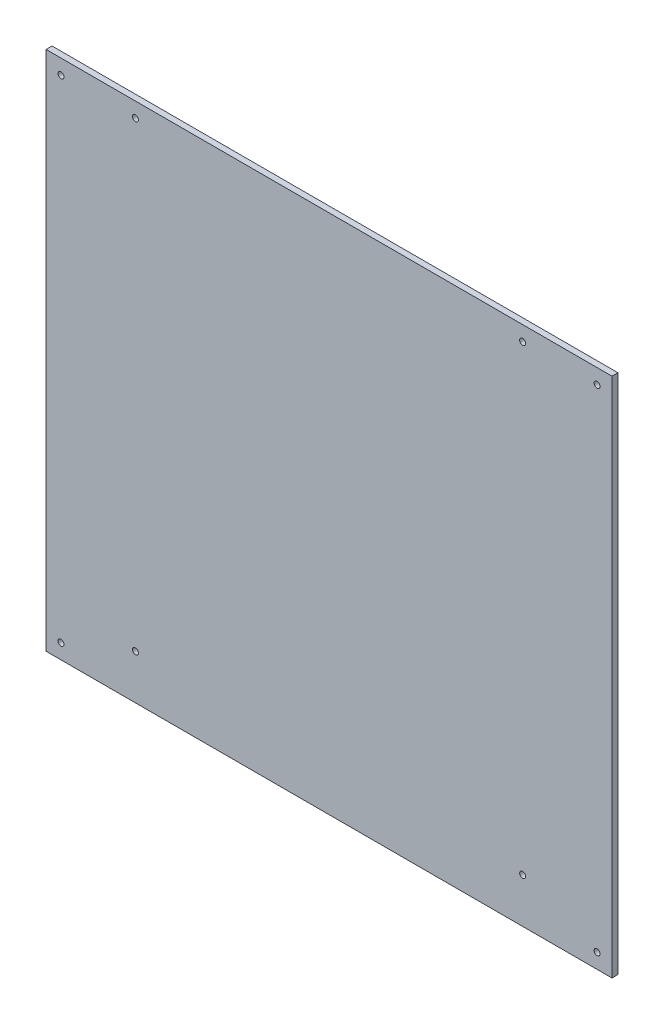
from build123d import *

# Parameters (mm, degrees)
SKICA1_W                = 380
SKICA1_H                = 350
SKICA1_R                = 2
P_IDAT_VYSUNUT_M1_DEPTH = 4


with BuildPart() as part:
    # Skica1 → Přidat vysunutím1 (new body)
    with BuildSketch(Plane.XY):
        Rectangle(SKICA1_W, SKICA1_H)
        with Locations((-180, 165)):
            Circle(SKICA1_R, mode=Mode.SUBTRACT)
        with Locations((180, 165)):
            Circle(SKICA1_R, mode=Mode.SUBTRACT)
        with Locations((180, -165)):
            Circle(SKICA1_R, mode=Mode.SUBTRACT)
        with Locations((-180, -165)):
            Circle(SKICA1_R, mode=Mode.SUBTRACT)
        with Locations((-130, 165)):
            Circle(SKICA1_R, mode=Mode.SUBTRACT)
        with Locations((130, 165)):
            Circle(SKICA1_R, mode=Mode.SUBTRACT)
        with Locations((130, -145)):
            Circle(SKICA1_R, mode=Mode.SUBTRACT)
        with Locations((-130, -145)):
            Circle(SKICA1_R, mode=Mode.SUBTRACT)
    extrude(amount=P_IDAT_VYSUNUT_M1_DEPTH)


solid = part.part
